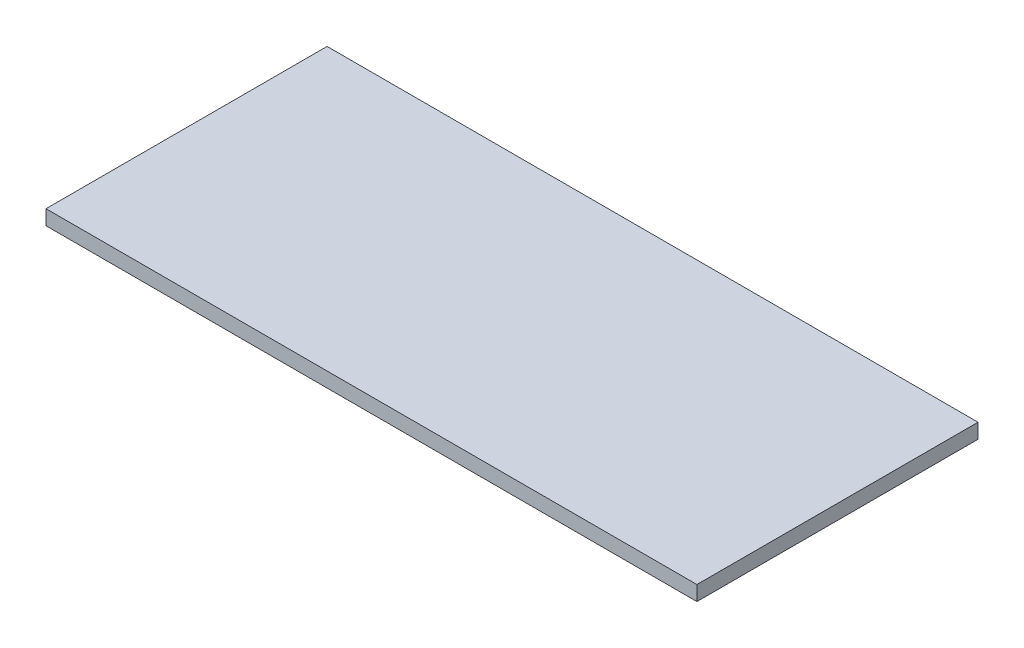
from build123d import *

# Parameters (mm, degrees)
SKETCH1_W           = 69.85
SKETCH1_H           = 30.1625
BOSS_EXTRUDE1_DEPTH = 1.5875


with BuildPart() as part:
    # Sketch1 → Boss-Extrude1 (new body)
    with BuildSketch(Plane(origin=(0, 0, 0), x_dir=(1, 0, 0), z_dir=(0, 1, 0))):
        Rectangle(SKETCH1_W, SKETCH1_H)
    extrude(amount=BOSS_EXTRUDE1_DEPTH)


solid = part.part
